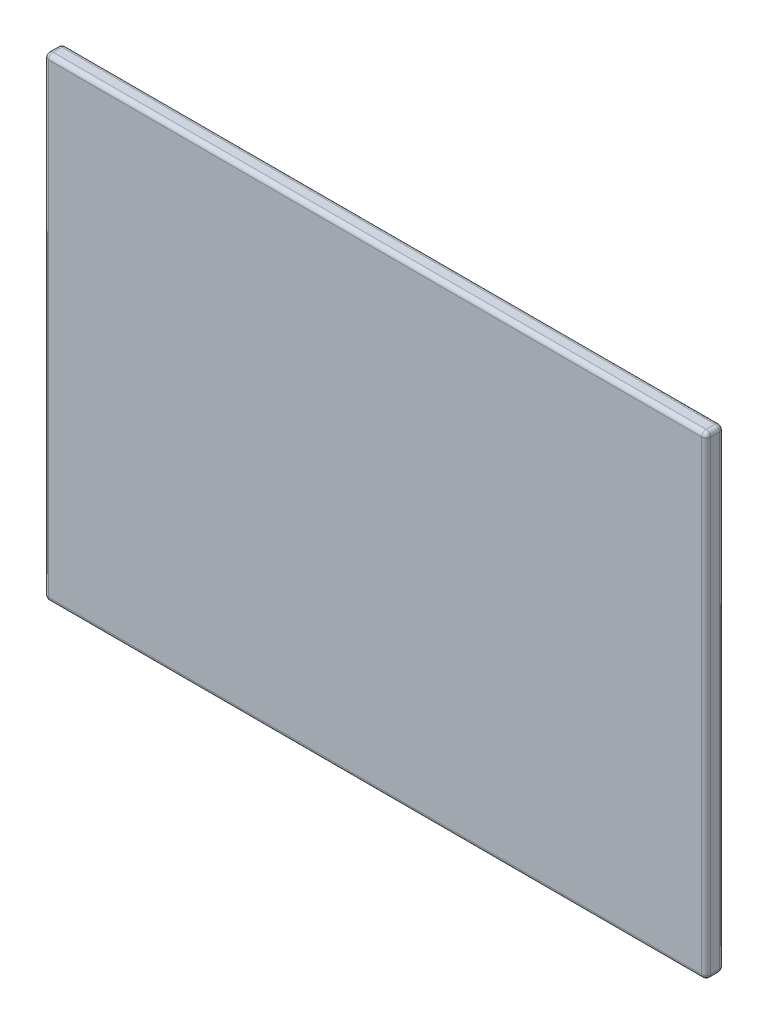
from build123d import *

# Parameters (mm, degrees)
SKETCH1_W           = 74.7
SKETCH1_H           = 53.5
BOSS_EXTRUDE1_DEPTH = 2
FILLET1_R           = 0.5


with BuildPart() as part:
    # Sketch1 → Boss-Extrude1 (new body)
    with BuildSketch(Plane.XY):
        Rectangle(SKETCH1_W, SKETCH1_H)
    extrude(amount=BOSS_EXTRUDE1_DEPTH)

    # Fillet1
    fillet1_edges = [part.edges().sort_by_distance(p)[0] for p in [
        (-37.35, 0, 2),
        (0, -26.75, 2),
        (37.35, 0, 2),
        (0, -26.75, 0),
        (-37.35, 0, 0),
        (0, 26.75, 0),
        (37.35, 0, 0),
        (37.35, -26.75, 1),
        (-37.35, -26.75, 1),
        (-37.35, 26.75, 1),
        (37.35, 26.75, 1),
        (0, 26.75, 2),
    ]]
    fillet(fillet1_edges, radius=FILLET1_R)


solid = part.part
